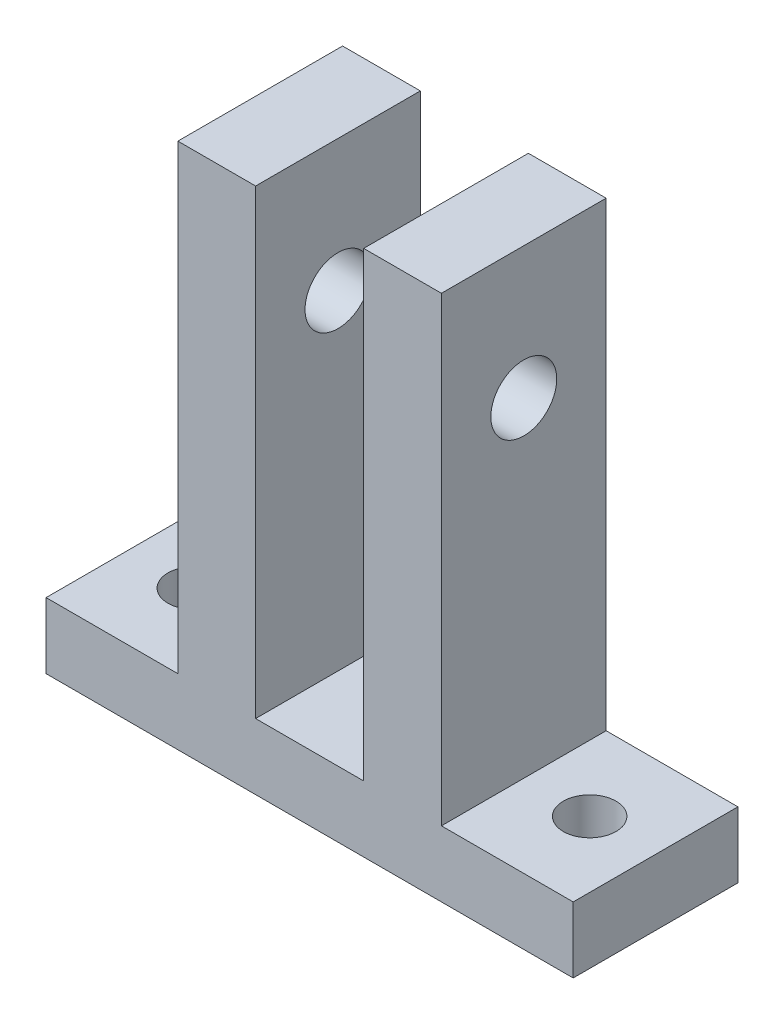
from build123d import *

# Parameters (mm, degrees)
EXTRUDE_1_DEPTH     = 12.5
SKETCH_2_R          = 2.5
CUT_EXTRUDE_2_DEPTH = 52.53882032
CUT_EXTRUDE_3_REACH = 56.601
SKETCH_3_R          = 2


with BuildPart() as part:
    # Эскиз1 → Вытянуть1 (new body)
    with BuildSketch(Plane.XY):
        Polygon((0, 0), (0, 5), (10, 5), (10, 40), (15.9, 40), (15.9, 5), (24.1, 5), (24.1, 40), (30, 40), (30, 5), (40, 5), (40, 0), align=None)
    extrude(amount=EXTRUDE_1_DEPTH)

    # Эскиз2 → Вытянуть2 (cut, through all)
    with BuildSketch(Plane.ZY.offset(-10)):
        with Locations((6.25, 30)):
            Circle(SKETCH_2_R)
    extrude(amount=-CUT_EXTRUDE_2_DEPTH, mode=Mode.SUBTRACT)

    # Эскиз3 → Вытянуть3 (cut, up to next)
    with BuildSketch(Plane(origin=(0, 5, 0), x_dir=(1, 0, 0), z_dir=(0, 1, 0)), mode=Mode.PRIVATE) as cut_extrude_3_sk1:
        with Locations(Location((35, -6.25, 0), (0, 0, 270))):
            Circle(SKETCH_3_R)
    cut_extrude_3_tool1 = extrude(cut_extrude_3_sk1.sketch, amount=-CUT_EXTRUDE_3_REACH, mode=Mode.PRIVATE) & part.part
    # Эскиз3 → Вытянуть3 (cut, up to next)
    with BuildSketch(Plane(origin=(0, 5, 0), x_dir=(1, 0, 0), z_dir=(0, 1, 0)), mode=Mode.PRIVATE) as cut_extrude_3_sk2:
        with Locations(Location((5, -6.25, 0), (0, 0, 270))):
            Circle(SKETCH_3_R)
    cut_extrude_3_tool2 = extrude(cut_extrude_3_sk2.sketch, amount=-CUT_EXTRUDE_3_REACH, mode=Mode.PRIVATE) & part.part
    add(cut_extrude_3_tool1.solids().sort_by_distance((35, 5, 6.25))[0], mode=Mode.SUBTRACT)
    add(cut_extrude_3_tool2.solids().sort_by_distance((5, 5, 6.25))[0], mode=Mode.SUBTRACT)


solid = part.part
